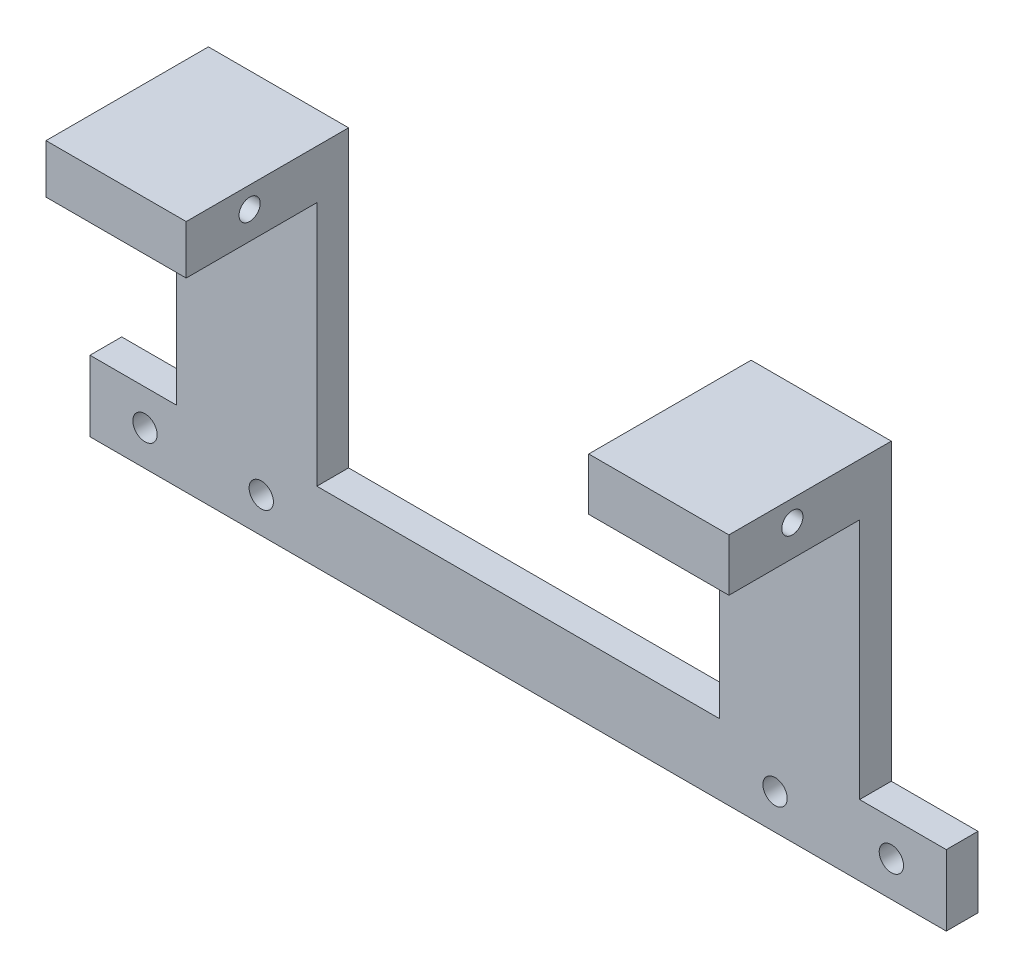
from build123d import *

# Parameters (mm, degrees)
SKETCH_1_R          = 1.15
EXTRUDE_1_DEPTH     = 3
SKETCH_2_W          = 13.26
SKETCH_2_H          = 4.63
SKETCH_2_H_2        = 4.947868295
EXTRUDE_2_DEPTH     = 12.36
SKETCH_3_R          = 1
CUT_EXTRUDE_1_DEPTH = 100


with BuildPart() as part:
    # 草图1 → 凸台-拉伸1 (new body)
    with BuildSketch(Plane.XY):
        Polygon((-32.300556088, -10.432591376), (-32.300556088, 17.427408624), (-19.040556088, 17.427408624), (-19.040556088, -10.432591376), (19.033443912, -10.432591376), (19.033443912, 17.427408624), (32.293443912, 17.427408624), (32.293443912, -10.432591376), (40.493443912, -10.432591376), (40.493443912, -17.112591376), (-40.500556088, -17.112591376), (-40.500556088, -10.432591376), align=None)
        with Locations((-35.300556088, -13.772591376)):
            Circle(SKETCH_1_R, mode=Mode.SUBTRACT)
        with Locations((-24.300556088, -13.772591376)):
            Circle(SKETCH_1_R, mode=Mode.SUBTRACT)
        with Locations((24.299443912, -13.772591376)):
            Circle(SKETCH_1_R, mode=Mode.SUBTRACT)
        with Locations((35.299443912, -13.772591376)):
            Circle(SKETCH_1_R, mode=Mode.SUBTRACT)
    extrude(amount=EXTRUDE_1_DEPTH)

    # 草图2 → 凸台-拉伸2 (add)
    with BuildSketch(Plane.XY.offset(3)):
        with Locations((-25.670556088, 15.112408624)):
            Rectangle(SKETCH_2_W, SKETCH_2_H)
        with Locations((25.663443912, 14.953474477)):
            Rectangle(SKETCH_2_W, SKETCH_2_H_2)
    extrude(amount=EXTRUDE_2_DEPTH)

    # 草图3 → 切除-拉伸1 (cut)
    with BuildSketch(Plane.ZY.offset(32.300556088)):
        with Locations((9.36, 15.427408624)):
            Circle(SKETCH_3_R)
    extrude(amount=-CUT_EXTRUDE_1_DEPTH, mode=Mode.SUBTRACT)


solid = part.part
